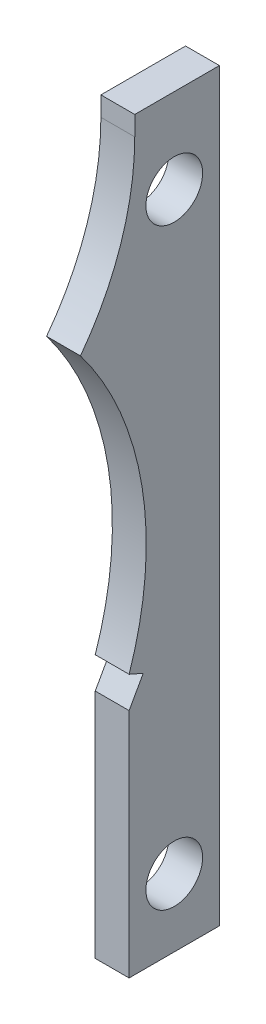
from build123d import *

# Parameters (mm, degrees)
BOSS_EXTRUDE1_DEPTH = 3
SKETCH3_R           = 5.025
CUT_EXTRUDE1_DEPTH  = 71.697893831


with BuildPart() as part:
    # Sketch1 → Boss-Extrude1 (new, symmetric)
    with BuildSketch(Plane(origin=(0, 0, 0), x_dir=(0, 0, -1), z_dir=(1, 0, 0))):
        with BuildLine():
            Line((0, 66), (-15, 66))
            Line((-15, 66), (-15, 62.56))
            ThreePointArc((-15, 62.56), (-17.468868001, 47.38033448), (-24.620970576, 33.765453531))
            ThreePointArc((-24.620970576, 33.765453531), (-13.706982887, 8.251900539), (-16, -19.403091525))
            Line((-16, -19.403091525), (-13.500700251, -20.50145429))
            Line((-13.500700251, -20.50145429), (-16, -24.97))
            Line((-16, -24.97), (-16, -66))
            Line((-16, -66), (0, -66))
            Line((0, -66), (0, 66))
        make_face()
    extrude(amount=BOSS_EXTRUDE1_DEPTH, both=True)

    # Sketch3 → Cut-Extrude1 (cut, through all)
    with BuildSketch(Plane(origin=(3, 0, 0), x_dir=(0, 0, -1), z_dir=(1, 0, 0))):
        with Locations((-8, 51)):
            Circle(SKETCH3_R)
        with Locations((-8, -54)):
            Circle(SKETCH3_R)
    extrude(amount=-CUT_EXTRUDE1_DEPTH, mode=Mode.SUBTRACT)


solid = part.part
